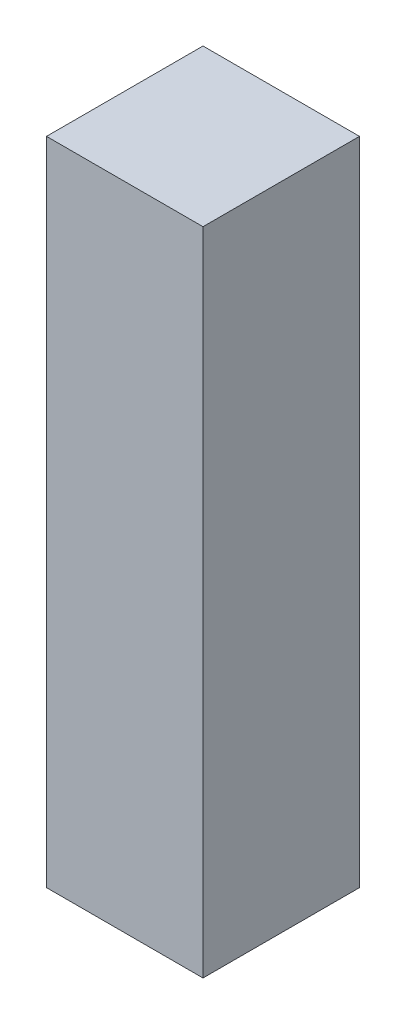
from build123d import *

# Parameters (mm, degrees)
SKETCH1_W           = 38
SKETCH1_H           = 38
BOSS_EXTRUDE1_DEPTH = 158


with BuildPart() as part:
    # Sketch1 → Boss-Extrude1 (new body)
    with BuildSketch(Plane(origin=(0, 0, 0), x_dir=(1, 0, 0), z_dir=(0, 1, 0))):
        with Locations((19, 19)):
            Rectangle(SKETCH1_W, SKETCH1_H)
    extrude(amount=BOSS_EXTRUDE1_DEPTH)


solid = part.part
